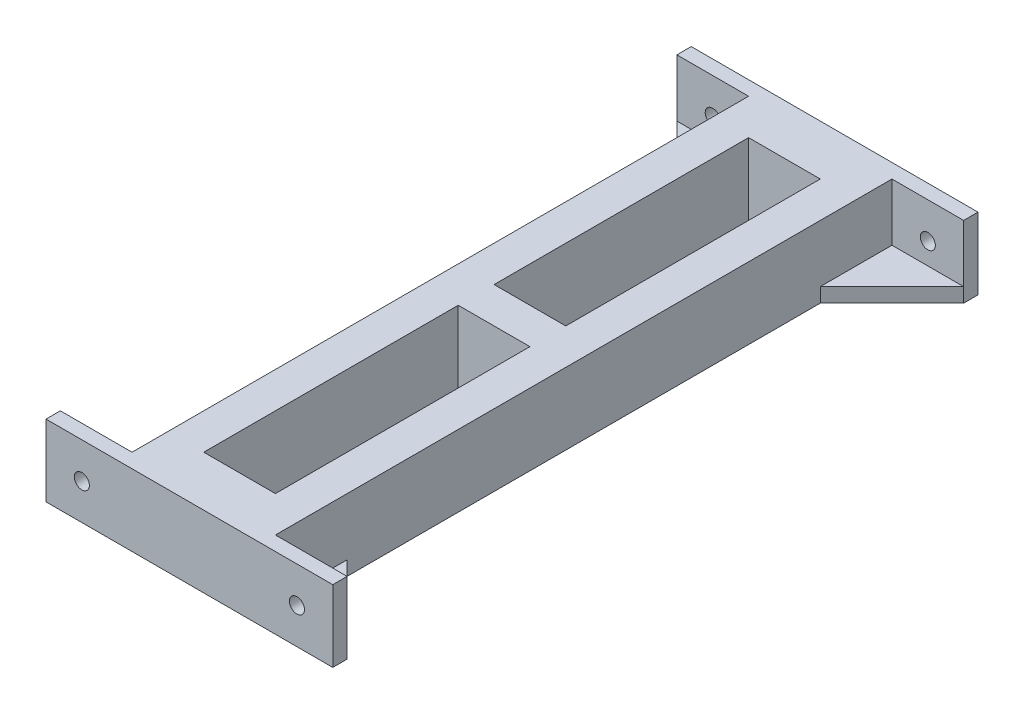
from build123d import *

# Parameters (mm, degrees)
BOSS_EXTRUDE1_DEPTH = 20
BOSS_EXTRUDE2_DEPTH = 4
SKETCH3_W           = 20
SKETCH3_H           = 71
CUT_EXTRUDE1_DEPTH  = 55
SKETCH6_R           = 2.1
CUT_EXTRUDE2_DEPTH  = 207


with BuildPart() as part:
    # Sketch1 → Boss-Extrude1 (new body)
    with BuildSketch(Plane(origin=(0, 0, 0), x_dir=(1, 0, 0), z_dir=(0, 1, 0))):
        Polygon((20, 176), (20, 4), (0, 4), (0, 0), (80, 0), (80, 4), (60, 4), (60, 176), (80, 176), (80, 180), (0, 180), (0, 176), align=None)
    extrude(amount=BOSS_EXTRUDE1_DEPTH)

    # Sketch2 → Boss-Extrude2 (add)
    with BuildSketch(Plane.XZ):
        Polygon((60, -4), (60, -24), (80, -4), align=None)
        Polygon((0, -4), (20, -24), (20, -4), align=None)
        Polygon((0, -176), (20, -176), (20, -156), align=None)
        Polygon((60, -176), (80, -176), (60, -156), align=None)
    extrude(amount=-BOSS_EXTRUDE2_DEPTH)

    # Sketch3 → Cut-Extrude1 (cut)
    with BuildSketch(Plane(origin=(0, 20, 0), x_dir=(1, 0, 0), z_dir=(0, 1, 0))):
        with Locations((40, 49.5)):
            Rectangle(SKETCH3_W, SKETCH3_H)
        with Locations((40, 130.5)):
            Rectangle(SKETCH3_W, SKETCH3_H)
    extrude(amount=-CUT_EXTRUDE1_DEPTH, mode=Mode.SUBTRACT)

    # Sketch6 → Cut-Extrude2 (cut)
    with BuildSketch(Plane.XY):
        with Locations((10, 10)):
            Circle(SKETCH6_R)
        with Locations((70, 10)):
            Circle(SKETCH6_R)
    extrude(amount=-CUT_EXTRUDE2_DEPTH, mode=Mode.SUBTRACT)


solid = part.part
